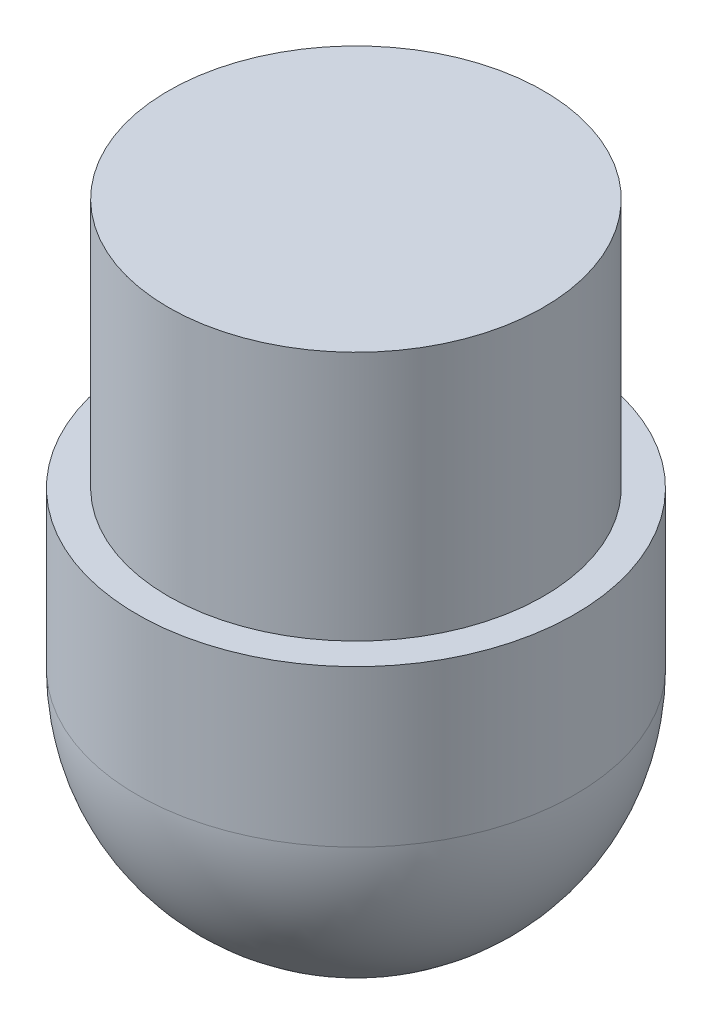
from build123d import *

# Parameters (mm, degrees)
SKETCH1_R           = 15
BOSS_EXTRUDE1_DEPTH = 20
SKETCH2_R           = 17.5
BOSS_EXTRUDE2_DEPTH = 12.5
DOME1_FACE_RADIUS   = 17.5
DOME1_HEIGHT        = 17.5


with BuildPart() as part:
    # Sketch1 → Boss-Extrude1 (new body)
    with BuildSketch(Plane(origin=(0, 0, 0), x_dir=(1, 0, 0), z_dir=(0, 1, 0))):
        with Locations(Location((0, 0, 0), (0, 0, 270))):
            Circle(SKETCH1_R)
    extrude(amount=BOSS_EXTRUDE1_DEPTH)

    # Sketch2 → Boss-Extrude2 (add)
    with BuildSketch(Plane.XZ):
        with Locations(Location((0, 0, 0), (0, 0, 270))):
            Circle(SKETCH2_R)
    extrude(amount=BOSS_EXTRUDE2_DEPTH)

    # Dome1: a dome of height H over a round flat face of radius A is a cap of a sphere of radius (A * A + H * H) / (2 * H)
    dome1_r = (DOME1_FACE_RADIUS * DOME1_FACE_RADIUS + DOME1_HEIGHT * DOME1_HEIGHT) / (2 * DOME1_HEIGHT)
    dome1_base = Plane((0, -12.5, 0), z_dir=(0, -1, 0))
    with Locations(dome1_base.offset(DOME1_HEIGHT - dome1_r)):
        dome1_ball = Sphere(dome1_r, mode=Mode.PRIVATE)
    add(split(dome1_ball, bisect_by=dome1_base, keep=Keep.TOP, mode=Mode.PRIVATE))


solid = part.part
